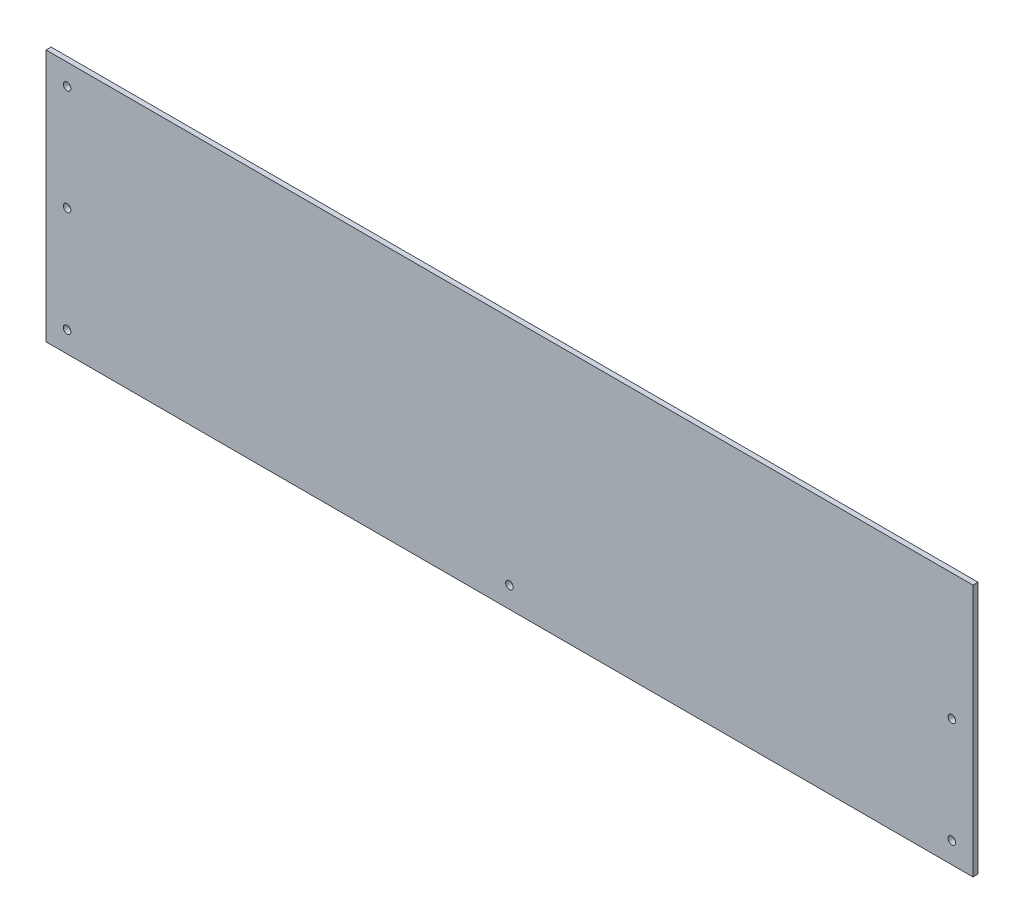
from build123d import *

# Parameters (mm, degrees)
SKETCH1_W            = 550
SKETCH1_H            = 150
BOSS_EXTRUDE1_DEPTH  = 3
M4_CLEARANCE_HOLE1_D = 4.5


with BuildPart() as part:
    # Sketch1 → Boss-Extrude1 (new body)
    with BuildSketch(Plane.XY):
        with Locations((275, 75)):
            Rectangle(SKETCH1_W, SKETCH1_H)
    extrude(amount=BOSS_EXTRUDE1_DEPTH)

    # M4 Clearance Hole1 (through all)
    with Locations(Plane.XY.offset(3)):
        with Locations((12.5, 75), (12.5, 137.5), (12.5, 12.5), (275, 12.5), (537.5, 12.5), (537.5, 75), (537.5, 237.5)):
            Hole(M4_CLEARANCE_HOLE1_D / 2)


solid = part.part
